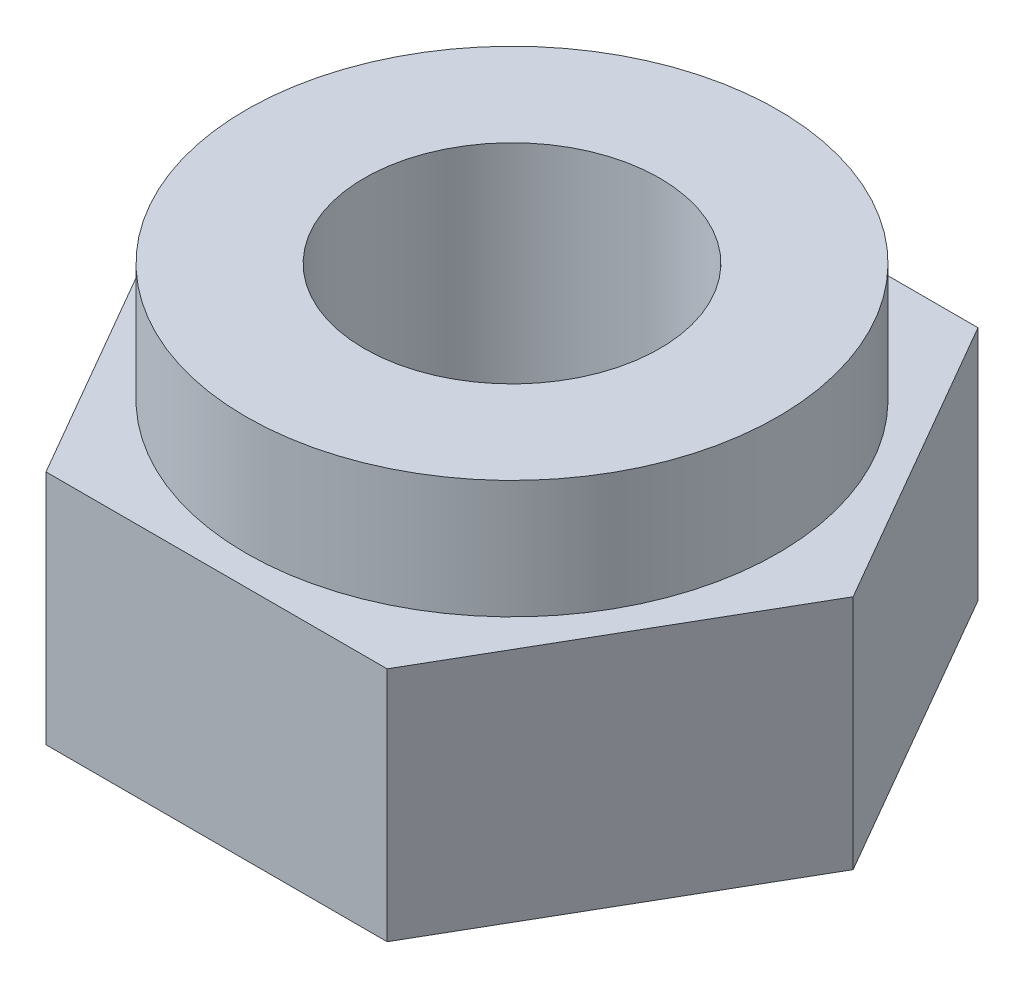
from build123d import *

# Parameters (mm, degrees)
EXTRUDE_1_DEPTH     = 3
CUT_EXTRUDE_1_REACH = 6.856
SKETCH_2_R          = 1.25
SKETCH_3_OUTSIDE_W  = 9.416
SKETCH_3_OUTSIDE_H  = 8.642
SKETCH_3_OUTSIDE_R  = 2.25
CUT_EXTRUDE_2_DEPTH = 1


with BuildPart() as part:
    # 草图1 → 凸台-拉伸1 (new body)
    with BuildSketch(Plane(origin=(0, 0, 0), x_dir=(1, 0, 0), z_dir=(0, 1, 0))):
        Polygon((2.886751346, 0), (1.443375673, 2.5), (-1.443375673, 2.5), (-2.886751346, 0), (-1.443375673, -2.5), (1.443375673, -2.5), align=None)
    extrude(amount=EXTRUDE_1_DEPTH)

    # 草图2 → 切除-拉伸1 (cut, up to next)
    with BuildSketch(Plane(origin=(0, 3, 0), x_dir=(1, 0, 0), z_dir=(0, 1, 0)), mode=Mode.PRIVATE) as cut_extrude_1_sk1:
        with Locations(Location((0, 0, 0), (0, 0, 270))):
            Circle(SKETCH_2_R)
    cut_extrude_1_tool1 = extrude(cut_extrude_1_sk1.sketch, amount=-CUT_EXTRUDE_1_REACH, mode=Mode.PRIVATE) & part.part
    add(cut_extrude_1_tool1.solids().sort_by_distance((0, 3, 0))[0], mode=Mode.SUBTRACT)

    # 草图3 outside → 切除-拉伸2 (cut)
    with BuildSketch(Plane(origin=(0, 3, 0), x_dir=(1, 0, 0), z_dir=(0, 1, 0))):
        Rectangle(SKETCH_3_OUTSIDE_W, SKETCH_3_OUTSIDE_H)
        with Locations(Location((0, 0, 0), (0, 0, 270))):
            Circle(SKETCH_3_OUTSIDE_R, mode=Mode.SUBTRACT)
    extrude(amount=-CUT_EXTRUDE_2_DEPTH, mode=Mode.SUBTRACT)


solid = part.part
